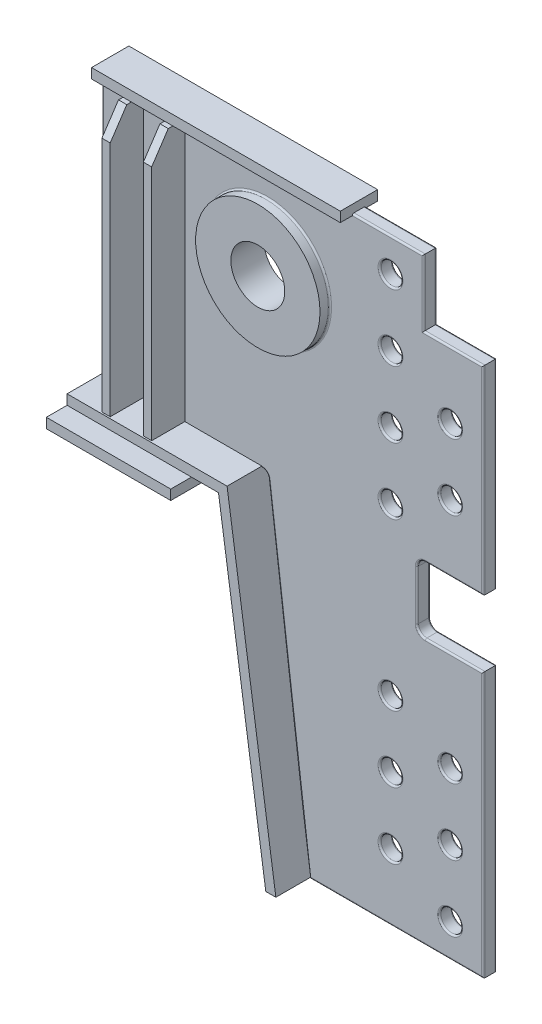
from build123d import *

# Parameters (mm, degrees)
SKETCH_1_R           = 13
SKETCH_1_R_2         = 37.5
EXTRUDE_1404_DEPTH   = 16
EXTRUDE_1_DEPTH      = 12
EXTRUDE_1_DEPTH_BACK = 28
SKETCH_2_R           = 75
SKETCH_2_R_2         = 32.5
FILLET_1_R           = 2
FILLET_2_R           = 2
EXTRUDE_2_DEPTH      = 40
EXTRUDE_2_DEPTH_BACK = 56
SKETCH_3_W           = 10
SKETCH_3_H           = 316
CUT_EXTRUDE_1_DEPTH  = 836.425640018
CUT_EXTRUDE_2_DEPTH  = 836.425640018
EXTRUDE_5_DEPTH      = 42
EXTRUDE_5_DEPTH_BACK = 58
EXTRUDE_6_DEPTH      = 14.5
EXTRUDE_6_DEPTH_BACK = 30.5
SKETCH_7_W           = 300
SKETCH_7_H           = 12
SKETCH_8_W           = 150
SKETCH_8_H           = 150
EXTRUDE_7_DEPTH      = 12


with BuildPart() as part:
    # 草图1 → Extrude 1404 (new body)
    with BuildSketch(Plane.XY):
        with BuildLine():
            Line((0, -320), (-70, -320))
            ThreePointArc((-70, -320), (-77.071067812, -322.928932188), (-80, -330))
            Line((-80, -330), (-80, -390))
            ThreePointArc((-80, -390), (-77.071067812, -397.071067812), (-70, -400))
            Line((-70, -400), (0, -400))
            Line((0, -400), (0, -720))
            Line((0, -720), (-210, -720))
            Line((-210, -720), (-259.124034735, -327.007722123))
            ThreePointArc((-259.124034735, -327.007722123), (-261.767837242, -322.002574593), (-267.062257748, -320))
            Line((-267.062257748, -320), (-460, -320))
            Line((-460, -320), (-460, 0))
            Line((-460, 0), (-72, 0))
            Line((-72, 0), (-72, -80))
            Line((-72, -80), (0, -80))
            Line((0, -80), (0, -320))
        make_face()
        with Locations((-112, -40)):
            Circle(SKETCH_1_R, mode=Mode.SUBTRACT)
        with Locations((-112, -120)):
            Circle(SKETCH_1_R, mode=Mode.SUBTRACT)
        with Locations((-112, -200)):
            Circle(SKETCH_1_R, mode=Mode.SUBTRACT)
        with Locations((-112, -280)):
            Circle(SKETCH_1_R, mode=Mode.SUBTRACT)
        with Locations((-40, -160)):
            Circle(SKETCH_1_R, mode=Mode.SUBTRACT)
        with Locations((-40, -240)):
            Circle(SKETCH_1_R, mode=Mode.SUBTRACT)
        with Locations((-40, -680)):
            Circle(SKETCH_1_R, mode=Mode.SUBTRACT)
        with Locations((-40, -600)):
            Circle(SKETCH_1_R, mode=Mode.SUBTRACT)
        with Locations((-40, -520)):
            Circle(SKETCH_1_R, mode=Mode.SUBTRACT)
        with Locations((-112, -640)):
            Circle(SKETCH_1_R, mode=Mode.SUBTRACT)
        with Locations((-112, -560)):
            Circle(SKETCH_1_R, mode=Mode.SUBTRACT)
        with Locations((-112, -480)):
            Circle(SKETCH_1_R, mode=Mode.SUBTRACT)
        with Locations((-260, -110)):
            Circle(SKETCH_1_R_2, mode=Mode.SUBTRACT)
    extrude(amount=EXTRUDE_1404_DEPTH)

    # 草图2 → 凸台-拉伸1 (add, two sides: drawn at the far end of the back side and taken through both)
    with BuildSketch(Plane.XY.offset(16).offset(-EXTRUDE_1_DEPTH_BACK)):
        with Locations((-260, -110)):
            Circle(SKETCH_2_R)
        with Locations((-260, -110)):
            Circle(SKETCH_2_R_2, mode=Mode.SUBTRACT)
    extrude(amount=EXTRUDE_1_DEPTH + EXTRUDE_1_DEPTH_BACK)

    # 圆角1
    fillet_1_edges = [part.edges().sort_by_distance(p)[0] for p in [
        (-105, -720, 16),
        (0, -560, 16),
        (-35, -400, 16),
        (-77.071067812, -397.071067812, 16),
        (-80, -360, 16),
        (-77.071067812, -322.928932188, 16),
        (-35, -320, 16),
        (0, -200, 16),
        (-36, -80, 16),
        (-125, -40, 16),
        (-72, -40, 16),
        (-261.767837242, -322.002574593, 16),
        (-266, 0, 16),
        (-125, -120, 16),
        (-460, -160, 16),
        (-125, -200, 16),
        (-363.531128874, -320, 16),
        (-125, -280, 16),
        (-53, -160, 16),
        (-53, -240, 16),
        (-53, -680, 16),
        (-53, -600, 16),
        (-53, -520, 16),
        (-234.562017367, -523.503861062, 16),
        (-125, -640, 16),
        (-125, -560, 16),
        (-125, -480, 16),
        (-335, -110, 16),
    ]]
    fillet(fillet_1_edges, radius=FILLET_1_R)

    # 圆角2
    fillet_2_edges = [part.edges().sort_by_distance(p)[0] for p in [
        (-363.531128874, -320, 0),
        (-460, -160, 0),
        (-266, 0, 0),
        (-72, -40, 0),
        (-36, -80, 0),
        (0, -200, 0),
        (-35, -320, 0),
        (-77.071067812, -322.928932188, 0),
        (-80, -360, 0),
        (-77.071067812, -397.071067812, 0),
        (-35, -400, 0),
        (0, -560, 0),
        (-105, -720, 0),
        (-234.562017367, -523.503861062, 0),
        (-261.767837242, -322.002574593, 0),
        (-125, -40, 0),
        (-125, -120, 0),
        (-125, -200, 0),
        (-125, -280, 0),
        (-53, -160, 0),
        (-53, -240, 0),
        (-53, -680, 0),
        (-53, -600, 0),
        (-53, -520, 0),
        (-125, -640, 0),
        (-125, -560, 0),
        (-125, -480, 0),
        (-335, -110, 0),
    ]]
    fillet(fillet_2_edges, radius=FILLET_2_R)

    # 草图3 → 凸台-拉伸2 (add, two sides: drawn at the far end of the back side and taken through both)
    with BuildSketch(Plane.XY.offset(16).offset(-EXTRUDE_2_DEPTH_BACK)):
        with Locations((-415, -160)):
            Rectangle(SKETCH_3_W, SKETCH_3_H)
        with Locations((-365, -160)):
            Rectangle(SKETCH_3_W, SKETCH_3_H)
    extrude(amount=EXTRUDE_2_DEPTH + EXTRUDE_2_DEPTH_BACK)

    # 草图4 → 切除-拉伸1 (cut, through all)
    with BuildSketch(Plane.ZY.offset(420)):
        Polygon((-20, -2), (-45.5, -32), (-45.5, -2), align=None)
    extrude(amount=-CUT_EXTRUDE_1_DEPTH, mode=Mode.SUBTRACT)

    # 草图5 → 切除-拉伸2 (cut, through all)
    with BuildSketch(Plane.ZY.offset(420)):
        Polygon((36, -2), (56, -32), (56, -2), align=None)
    extrude(amount=-CUT_EXTRUDE_2_DEPTH, mode=Mode.SUBTRACT)

    # 草图6 → 凸台-拉伸5 (add, two sides: drawn at the far end of the back side and taken through both)
    with BuildSketch(Plane.XY.offset(16).offset(-EXTRUDE_5_DEPTH_BACK)):
        Polygon((-267.062257748, -318), (-460, -318), (-460, -330), (-277.426505546, -330), (-220.363518026, -718), (-208.234435563, -718), align=None)
    extrude(amount=EXTRUDE_5_DEPTH + EXTRUDE_5_DEPTH_BACK)

    # 草图7 → 凸台-拉伸6 (add, two sides: drawn at the far end of the back side and taken through both)
    with BuildSketch(Plane(origin=(0, 0, 0), x_dir=(-1, 0, 0), z_dir=(0, 0, -1)).offset(-EXTRUDE_6_DEPTH_BACK)):
        with Locations((308, 4)):
            Rectangle(SKETCH_7_W, SKETCH_7_H)
    extrude(amount=EXTRUDE_6_DEPTH + EXTRUDE_6_DEPTH_BACK)

    # 草图8 → 凸台-拉伸7 (add)
    with BuildSketch(Plane.XZ.offset(330)):
        with Locations((-385, 8)):
            Rectangle(SKETCH_8_W, SKETCH_8_H)
    extrude(amount=EXTRUDE_7_DEPTH)


solid = part.part
